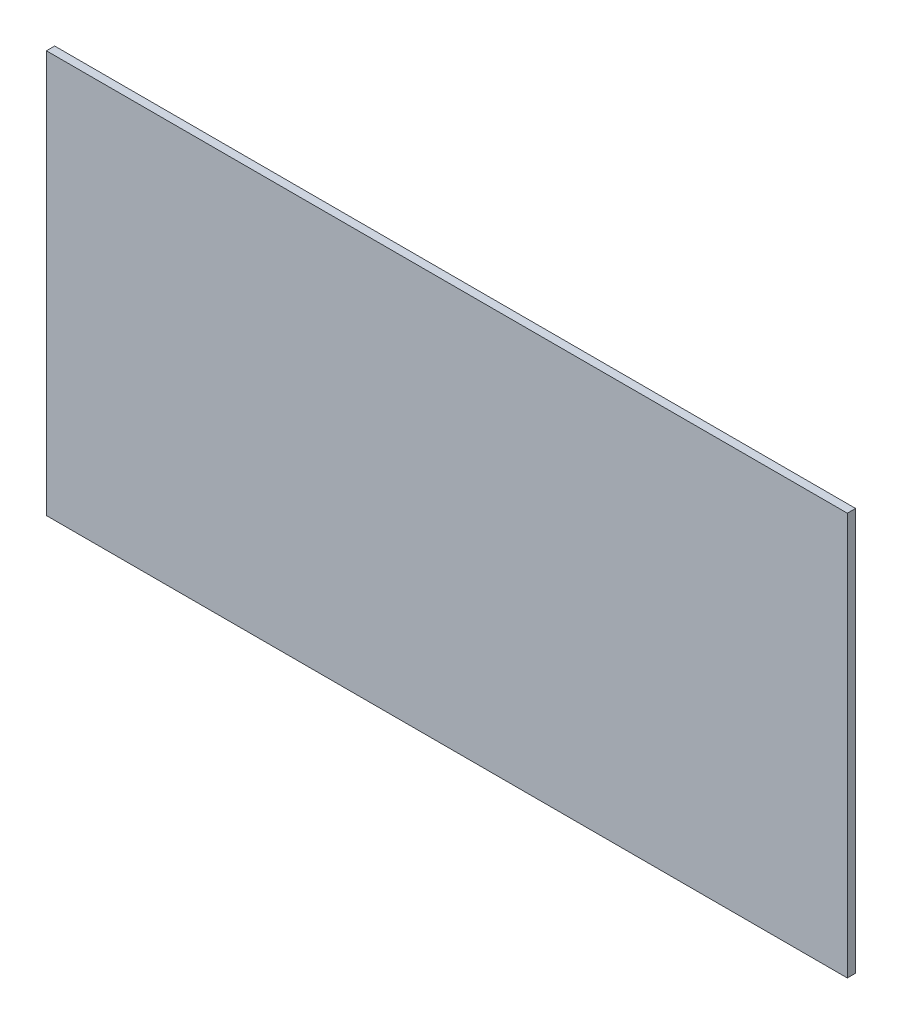
from build123d import *

# Parameters (mm, degrees)
SKICA1_W                = 388
SKICA1_H                = 195
P_IDAT_VYSUNUT_M1_DEPTH = 4


with BuildPart() as part:
    # Skica1 → Přidat vysunutím1 (new body)
    with BuildSketch(Plane.XY):
        Rectangle(SKICA1_W, SKICA1_H)
    extrude(amount=P_IDAT_VYSUNUT_M1_DEPTH)


solid = part.part
